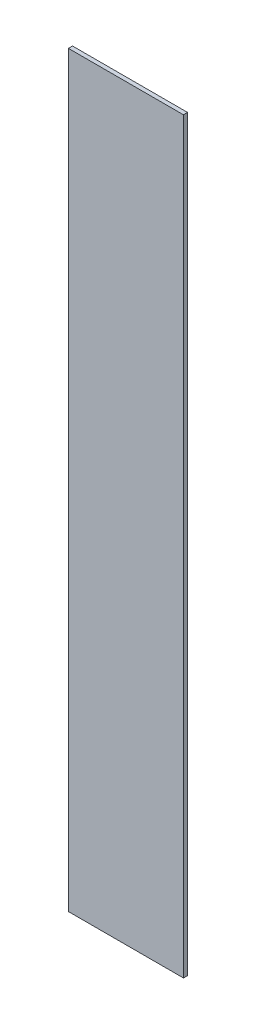
from build123d import *

# Parameters (mm, degrees)
PACK_SARJOR_KAPISI_KULP_CUKURU_1_START = 26
SKETCH1_W                              = 28
SKETCH1_H                              = 182
PACK_SARJOR_KAPISI_KULP_CUKURU_1_DEPTH = 1


with BuildPart() as part:
    # Sketch1 → PACK_sarjor_kapisi_kulp_cukuru_1 (new body)
    with BuildSketch(Plane.XY.offset(PACK_SARJOR_KAPISI_KULP_CUKURU_1_START)):
        with Locations((637, 1495)):
            Rectangle(SKETCH1_W, SKETCH1_H)
    extrude(amount=PACK_SARJOR_KAPISI_KULP_CUKURU_1_DEPTH)


solid = part.part
